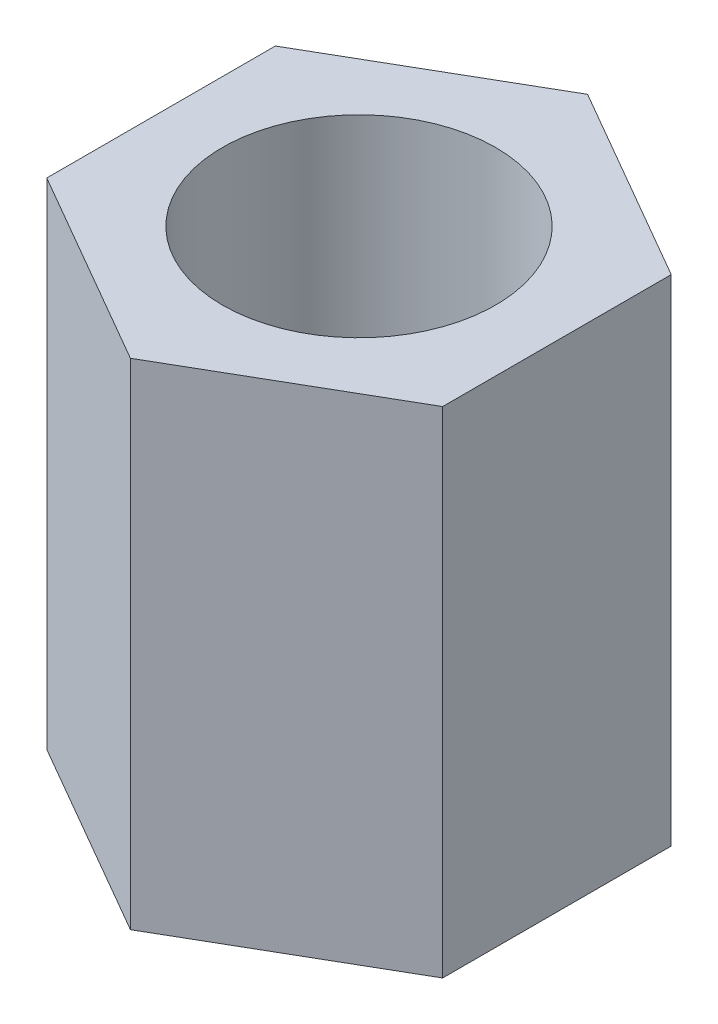
from build123d import *

# Parameters (mm, degrees)
SKETCH1_R           = 1.7526
BOSS_EXTRUDE1_DEPTH = 6.35


with BuildPart() as part:
    # Sketch1 → Boss-Extrude1 (new body)
    with BuildSketch(Plane(origin=(0, 0, 0), x_dir=(1, 0, 0), z_dir=(0, 1, 0))):
        Polygon((0, 2.932939367), (-2.54, 1.466469684), (-2.54, -1.466469684), (0, -2.932939367), (2.54, -1.466469684), (2.54, 1.466469684), align=None)
        with Locations(Location((0, 0, 0), (0, 0, 270))):
            Circle(SKETCH1_R, mode=Mode.SUBTRACT)
    extrude(amount=BOSS_EXTRUDE1_DEPTH)


solid = part.part
